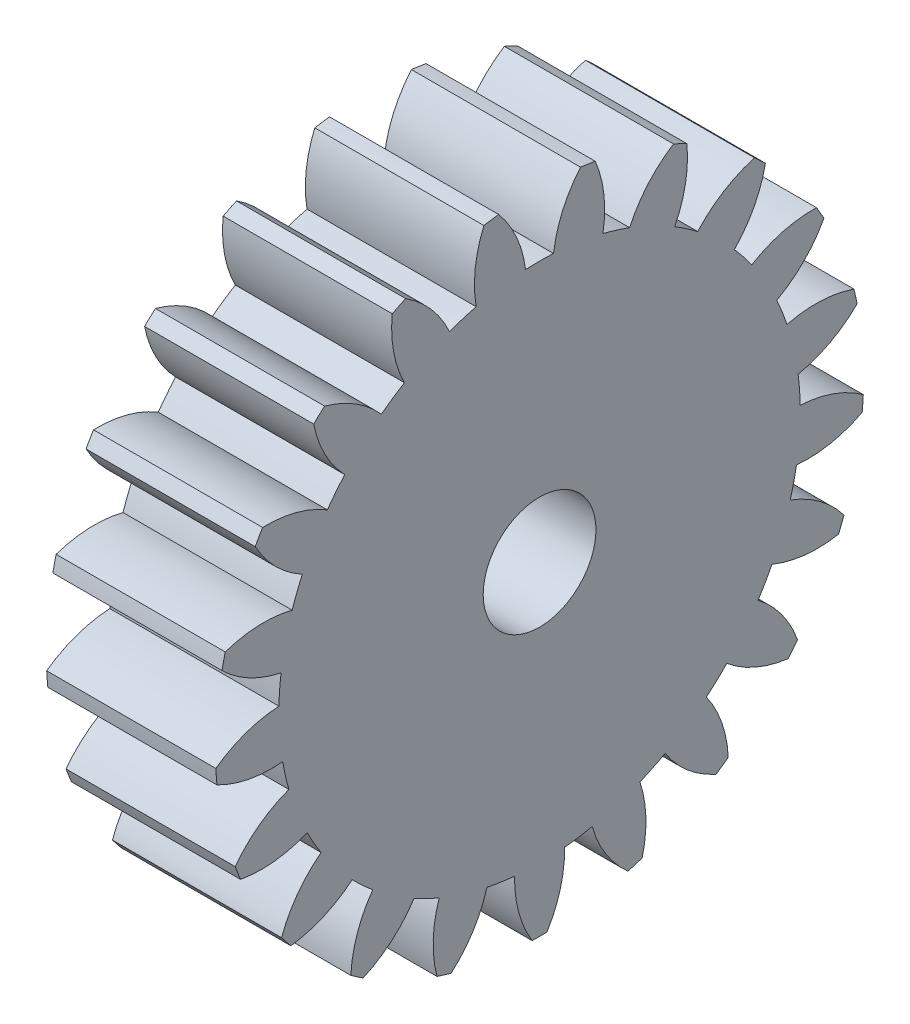
from build123d import *

# Parameters (mm, degrees)
BASPROSKE_W           = 12
BASPROSKE_H           = 5.75
TOOTHCUT_DEPTH        = 15.495689014
TEETHCUTS_COUNT       = 21
TEETHCUTS_ANGLE       = 342.857142857
BORSKE_R              = 1
BORE_DEPTH            = 50.0000508
CROQUIS1_W            = 14.068559573
CROQUIS1_H            = 12.667308619
CORTAR_EXTRUIR1_DEPTH = 9


with BuildPart() as part:
    # BasProSke → Base-Revolve (revolve)
    with BuildSketch(Plane(origin=(0, 0, 0), x_dir=(1, 0, 0), z_dir=(0, 1, 0)), mode=Mode.PRIVATE) as base_revolve_sk:
        with Locations((6, 2.875)):
            Rectangle(BASPROSKE_W, BASPROSKE_H)
    revolve(base_revolve_sk.sketch.rotate(Axis((-10, 0, 0), (1, 0, 0)), 180), axis=Axis((-10, 0, 0), (1, 0, 0)))

    # TooCutSke → ToothCut (cut, through all)
    with BuildSketch(Plane(origin=(0, 0, 0), x_dir=(0, 0, -1), z_dir=(1, 0, 0))):
        with BuildLine():
            ThreePointArc((0.247570178, 4.617367757), (0, 4.624), (-0.247570178, 4.617367757))
            ThreePointArc((-0.247570178, 4.617367757), (-0.414765128, 5.209076442), (-0.746177874, 5.726994302))
            ThreePointArc((-0.746177874, 5.726994302), (0, 5.7754), (0.746177874, 5.726994302))
            ThreePointArc((0.746177874, 5.726994302), (0.414765128, 5.209076442), (0.247570178, 4.617367757))
        make_face()
    toothcut = extrude(amount=TOOTHCUT_DEPTH, mode=Mode.SUBTRACT)

    # TeethCuts: ToothCut ×21 about axis
    teethcuts_axis = Axis((-10, 0, 0), (1, 0, 0))
    for i in range(1, TEETHCUTS_COUNT):
        add(toothcut.rotate(teethcuts_axis, i * TEETHCUTS_ANGLE / (TEETHCUTS_COUNT - 1)), mode=Mode.SUBTRACT)

    # BorSke → Bore (cut, symmetric)
    with BuildSketch(Plane(origin=(0, 0, 0), x_dir=(0, 0, -1), z_dir=(1, 0, 0))):
        with Locations(Location((0, 0, 0), (0, 0, 180))):
            Circle(BORSKE_R)
    extrude(amount=BORE_DEPTH, both=True, mode=Mode.SUBTRACT)

    # Croquis1 → Cortar-Extruir1 (cut)
    with BuildSketch(Plane.ZY):
        with Locations((0.635233766, 0.070382957)):
            Rectangle(CROQUIS1_W, CROQUIS1_H)
    extrude(amount=-CORTAR_EXTRUIR1_DEPTH, mode=Mode.SUBTRACT)


solid = part.part
